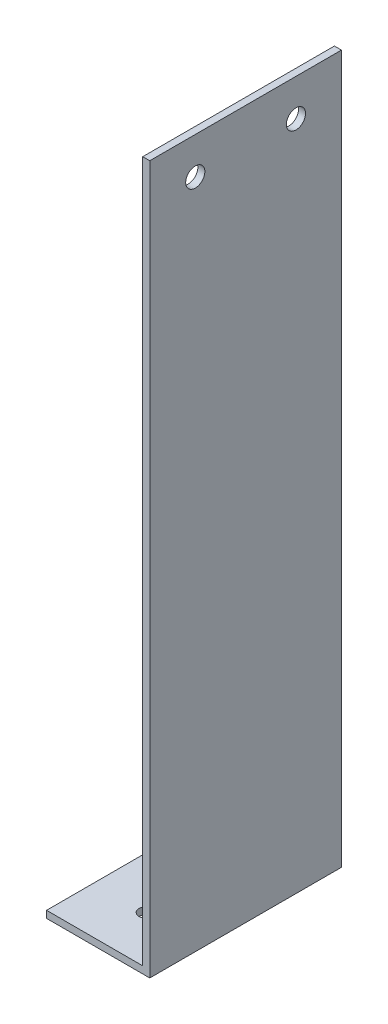
from build123d import *

# Parameters (mm, degrees)
SALIENTE_EXTRUIR1_DEPTH = 65
CROQUIS2_R              = 4.7625
CORTAR_EXTRUIR1_DEPTH   = 130
CROQUIS3_R              = 6.5
CORTAR_EXTRUIR2_DEPTH   = 130


with BuildPart() as part:
    # Croquis1 → Saliente-Extruir1 (new, symmetric)
    with BuildSketch(Plane.XY):
        Polygon((0, 0), (0, 480), (-4.7625, 480), (-4.7625, 4.7625), (-70, 4.7625), (-70, 0), align=None)
    extrude(amount=SALIENTE_EXTRUIR1_DEPTH, both=True)

    # Croquis2 → Cortar-Extruir1 (cut)
    with BuildSketch(Plane(origin=(0, 0, 0), x_dir=(-1, 0, 0), z_dir=(0, -1, 0))):
        with Locations(Location((35, -32.5, 0), (0, 0, 180))):
            Circle(CROQUIS2_R)
        with Locations(Location((35, 32.5, 0), (0, 0, 180))):
            Circle(CROQUIS2_R)
    extrude(amount=-CORTAR_EXTRUIR1_DEPTH, mode=Mode.SUBTRACT)

    # Croquis3 → Cortar-Extruir2 (cut)
    with BuildSketch(Plane(origin=(0, 0, 0), x_dir=(0, 0, -1), z_dir=(1, 0, 0))):
        with Locations((-34.13125, 455)):
            Circle(CROQUIS3_R)
        with Locations((34.13125, 455)):
            Circle(CROQUIS3_R)
    extrude(amount=-CORTAR_EXTRUIR2_DEPTH, mode=Mode.SUBTRACT)


solid = part.part
